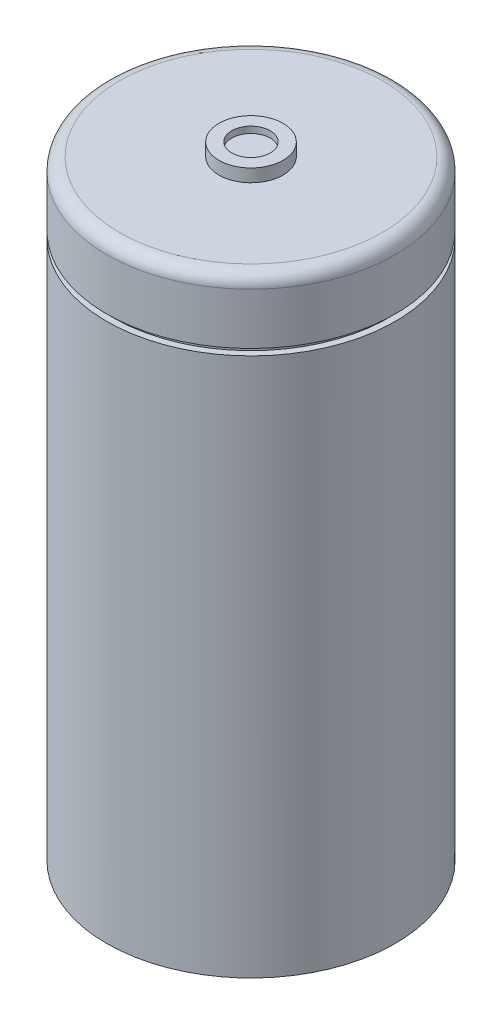
from build123d import *

# Parameters (mm, degrees)
SKETCH_1_R          = 22.5
EXTRUDE_1_DEPTH     = 95
SKETCH_2_W          = 1
SKETCH_2_H          = 1
FILLET_1_R          = 2
SKETCH_3_R          = 5
EXTRUDE_2_DEPTH     = 2
SKETCH_4_R          = 3
CUT_EXTRUDE_1_DEPTH = 1


with BuildPart() as part:
    # Эскиз1 → Бобышка-Вытянуть1 (new body)
    with BuildSketch(Plane(origin=(0, 0, 0), x_dir=(1, 0, 0), z_dir=(0, 1, 0))):
        with Locations(Location((0, 0, 0), (0, 0, 270))):
            Circle(SKETCH_1_R)
    extrude(amount=EXTRUDE_1_DEPTH)

    # Эскиз2 → Вырез-Повернуть1 (revolve, cut)
    with BuildSketch(Plane.XY, mode=Mode.PRIVATE) as cut_revolve_1_sk:
        with Locations((22, 84.5)):
            Rectangle(SKETCH_2_W, SKETCH_2_H)
    revolve(cut_revolve_1_sk.sketch.rotate(Axis((0, 95, 0), (0, -1, 0)), 180), axis=Axis((0, 95, 0), (0, -1, 0)), mode=Mode.SUBTRACT)

    # Скругление1
    fillet_1_edges = [part.edges().sort_by_distance(p)[0] for p in [
        (0, 95, -22.5),
    ]]
    fillet(fillet_1_edges, radius=FILLET_1_R)

    # Эскиз3 → Бобышка-Вытянуть2 (add)
    with BuildSketch(Plane(origin=(0, 95, 0), x_dir=(1, 0, 0), z_dir=(0, 1, 0))):
        with Locations(Location((0, 0, 0), (0, 0, 270))):
            Circle(SKETCH_3_R)
    extrude(amount=EXTRUDE_2_DEPTH)

    # Эскиз4 → Вырез-Вытянуть1 (cut)
    with BuildSketch(Plane(origin=(0, 97, 0), x_dir=(1, 0, 0), z_dir=(0, 1, 0))):
        with Locations(Location((0, 0, 0), (0, 0, 270))):
            Circle(SKETCH_4_R)
    extrude(amount=-CUT_EXTRUDE_1_DEPTH, mode=Mode.SUBTRACT)


solid = part.part
